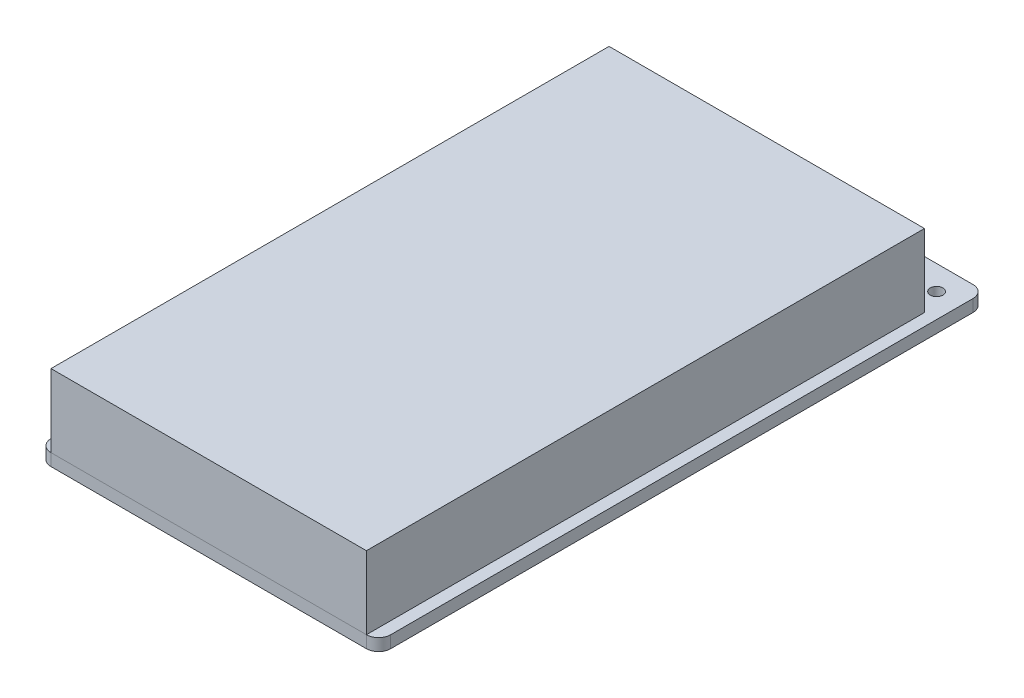
from build123d import *

# Parameters (mm, degrees)
SKETCH1_W               = 177.8
SKETCH1_H               = 317.5
BASE_DEPTH              = 6.35
HOLES_DEPTH             = 183.057944073
HOLES_DEPTH_BACK        = 183.057944073
SKETCH3_R               = 3.302
INNER_CUTOUT_DEPTH      = 183.057944073
INNER_CUTOUT_DEPTH_BACK = 183.057944073
FILLET1_R               = 6.35
SKETCH2_W               = 165.1
SKETCH2_H               = 292.1
PADDING_DEPTH           = 38.1


with BuildPart() as part:
    # Sketch1 → Base (new body)
    with BuildSketch(Plane(origin=(0, 0, 0), x_dir=(1, 0, 0), z_dir=(0, 1, 0))):
        Rectangle(SKETCH1_W, SKETCH1_H)
    extrude(amount=BASE_DEPTH)

    # Sketch3 → Holes (cut, two sides: drawn at the far end of the back side and taken through both)
    with BuildSketch(Plane.XZ.offset(-HOLES_DEPTH_BACK)):
        with Locations(Location((-76.2, -146.05, 0), (0, 0, 270))):
            Circle(SKETCH3_R)
        with Locations(Location((76.2, -146.05, 0), (0, 0, 270))):
            Circle(SKETCH3_R)
        with Locations(Location((76.2, 133.35, 0), (0, 0, 270))):
            Circle(SKETCH3_R)
        with Locations(Location((-76.2, 133.35, 0), (0, 0, 270))):
            Circle(SKETCH3_R)
    extrude(amount=HOLES_DEPTH + HOLES_DEPTH_BACK, mode=Mode.SUBTRACT)

    # Sketch6 → Inner Cutout (cut, two sides: drawn at the far end of the back side and taken through both)
    with BuildSketch(Plane.XZ.offset(-INNER_CUTOUT_DEPTH_BACK)):
        with BuildLine():
            Line((-76.2, 120.65), (-76.2, -133.35))
            ThreePointArc((-76.2, -133.35), (-67.219743879, -137.069743879), (-63.5, -146.05))
            Line((-63.5, -146.05), (63.5, -146.05))
            ThreePointArc((63.5, -146.05), (67.219743879, -137.069743879), (76.2, -133.35))
            Line((76.2, -133.35), (76.2, 120.65))
            ThreePointArc((76.2, 120.65), (67.219743879, 124.369743879), (63.5, 133.35))
            Line((63.5, 133.35), (-63.5, 133.35))
            ThreePointArc((-63.5, 133.35), (-67.219743879, 124.369743879), (-76.2, 120.65))
        make_face()
    extrude(amount=INNER_CUTOUT_DEPTH + INNER_CUTOUT_DEPTH_BACK, mode=Mode.SUBTRACT)

    # Fillet1
    fillet1_edges = [part.edges().sort_by_distance(p)[0] for p in [
        (-76.2, 3.175, 120.65),
        (-63.5, 3.175, 133.35),
        (63.5, 3.175, 133.35),
        (76.2, 3.175, 120.65),
        (76.2, 3.175, -133.35),
        (63.5, 3.175, -146.05),
        (-63.5, 3.175, -146.05),
        (-76.2, 3.175, -133.35),
        (88.9, 3.175, 158.75),
        (-88.9, 3.175, 158.75),
        (-88.9, 3.175, -158.75),
        (88.9, 3.175, -158.75),
    ]]
    fillet(fillet1_edges, radius=FILLET1_R)


with BuildPart() as body_2:
    # Sketch2 → Padding (new body)
    with BuildSketch(Plane(origin=(0, 6.35, 0), x_dir=(1, 0, 0), z_dir=(0, 1, 0))):
        with Locations((0, -12.7)):
            Rectangle(SKETCH2_W, SKETCH2_H)
    extrude(amount=PADDING_DEPTH)


solid = Compound([part.part, body_2.part])
